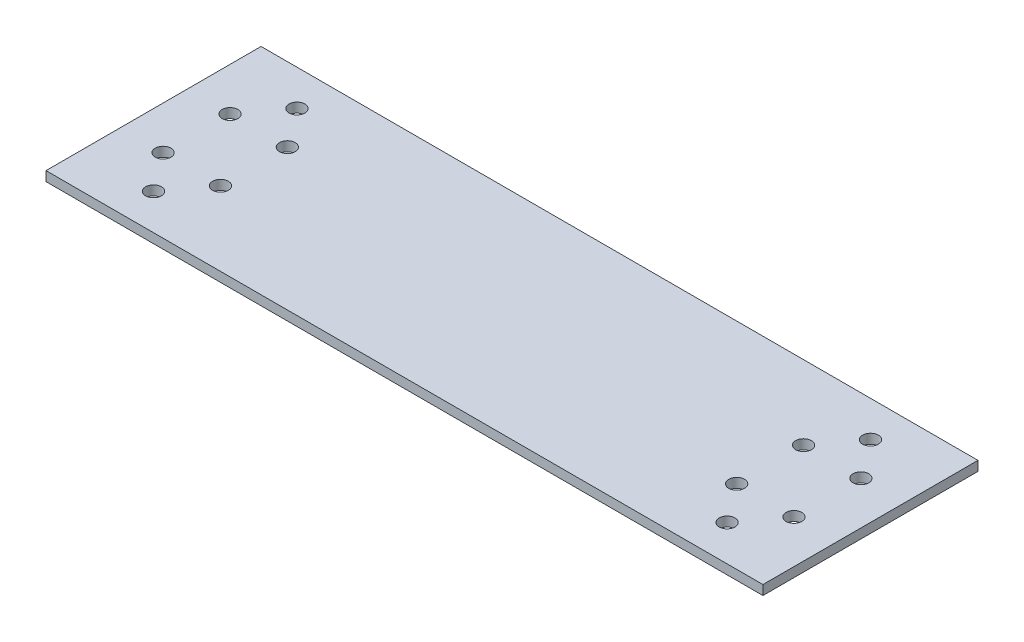
from build123d import *

# Parameters (mm, degrees)
SKETCH_1_W               = 150
SKETCH_1_H               = 45
EXTRUDE_1_DEPTH          = 2
CUT_EXTRUDE_1_REACH      = 80.328
SKETCH_2_R               = 1.65
MIRROR_2_COPY_1_REACH    = 80.328
MIRROR_2_COPY_1_SKETCH_R = 1.65


with BuildPart() as part:
    # 草图1 → 凸台-拉伸1 (new body)
    with BuildSketch(Plane(origin=(0, 0, 0), x_dir=(1, 0, 0), z_dir=(0, 1, 0))):
        Rectangle(SKETCH_1_W, SKETCH_1_H)
    extrude(amount=EXTRUDE_1_DEPTH)

    # 草图2 → 切除-拉伸1 (cut, up to next)
    with BuildSketch(Plane(origin=(0, 2, 0), x_dir=(1, 0, 0), z_dir=(0, 1, 0)), mode=Mode.PRIVATE) as cut_extrude_1_sk1:
        with Locations(Location((-60, 15, 0), (0, 0, 270))):
            Circle(SKETCH_2_R)
    cut_extrude_1_tool1 = extrude(cut_extrude_1_sk1.sketch, amount=-CUT_EXTRUDE_1_REACH, mode=Mode.PRIVATE) & part.part
    # 草图2 → 切除-拉伸1 (cut, up to next)
    with BuildSketch(Plane(origin=(0, 2, 0), x_dir=(1, 0, 0), z_dir=(0, 1, 0)), mode=Mode.PRIVATE) as cut_extrude_1_sk2:
        with Locations(Location((-66, 7, 0), (0, 0, 270))):
            Circle(SKETCH_2_R)
    cut_extrude_1_tool2 = extrude(cut_extrude_1_sk2.sketch, amount=-CUT_EXTRUDE_1_REACH, mode=Mode.PRIVATE) & part.part
    # 草图2 → 切除-拉伸1 (cut, up to next)
    with BuildSketch(Plane(origin=(0, 2, 0), x_dir=(1, 0, 0), z_dir=(0, 1, 0)), mode=Mode.PRIVATE) as cut_extrude_1_sk3:
        with Locations(Location((-54, 7, 0), (0, 0, 270))):
            Circle(SKETCH_2_R)
    cut_extrude_1_tool3 = extrude(cut_extrude_1_sk3.sketch, amount=-CUT_EXTRUDE_1_REACH, mode=Mode.PRIVATE) & part.part
    cut_extrude_1_1 = cut_extrude_1_tool1.solids().sort_by_distance((-60, 2, -15))[0]
    add(cut_extrude_1_1, mode=Mode.SUBTRACT)
    cut_extrude_1_2 = cut_extrude_1_tool2.solids().sort_by_distance((-66, 2, -7))[0]
    add(cut_extrude_1_2, mode=Mode.SUBTRACT)
    cut_extrude_1_3 = cut_extrude_1_tool3.solids().sort_by_distance((-54, 2, -7))[0]
    add(cut_extrude_1_3, mode=Mode.SUBTRACT)
    cut_extrude_1 = cut_extrude_1_1 + cut_extrude_1_2 + cut_extrude_1_3  # 切除-拉伸1 as one shape, for the pattern or mirror that repeats it

    # 镜向1: 切除-拉伸1 across plane
    add(cut_extrude_1.mirror(Plane.XY), mode=Mode.SUBTRACT)

    # 镜向2: 切除-拉伸1 across plane
    add(cut_extrude_1.mirror(Plane(origin=(0, 0, 0), x_dir=(0, 0, 1), z_dir=(1, 0, 0))), mode=Mode.SUBTRACT)

    # 镜向2 copy 1 sketch → 镜向2 copy 1 (cut, up to next)
    with BuildSketch(Plane(origin=(0, 2, 0), x_dir=(-1, 0, 0), z_dir=(0, 1, 0)), mode=Mode.PRIVATE) as mirror_2_copy_1_sk1:
        with Locations(Location((-60, 15, 0), (0, 0, 270))):
            Circle(MIRROR_2_COPY_1_SKETCH_R)
    mirror_2_copy_1_tool1 = extrude(mirror_2_copy_1_sk1.sketch, amount=-MIRROR_2_COPY_1_REACH, mode=Mode.PRIVATE) & part.part
    # 镜向2 copy 1 sketch → 镜向2 copy 1 (cut, up to next)
    with BuildSketch(Plane(origin=(0, 2, 0), x_dir=(-1, 0, 0), z_dir=(0, 1, 0)), mode=Mode.PRIVATE) as mirror_2_copy_1_sk2:
        with Locations(Location((-66, 7, 0), (0, 0, 270))):
            Circle(MIRROR_2_COPY_1_SKETCH_R)
    mirror_2_copy_1_tool2 = extrude(mirror_2_copy_1_sk2.sketch, amount=-MIRROR_2_COPY_1_REACH, mode=Mode.PRIVATE) & part.part
    # 镜向2 copy 1 sketch → 镜向2 copy 1 (cut, up to next)
    with BuildSketch(Plane(origin=(0, 2, 0), x_dir=(-1, 0, 0), z_dir=(0, 1, 0)), mode=Mode.PRIVATE) as mirror_2_copy_1_sk3:
        with Locations(Location((-54, 7, 0), (0, 0, 270))):
            Circle(MIRROR_2_COPY_1_SKETCH_R)
    mirror_2_copy_1_tool3 = extrude(mirror_2_copy_1_sk3.sketch, amount=-MIRROR_2_COPY_1_REACH, mode=Mode.PRIVATE) & part.part
    add(mirror_2_copy_1_tool1.solids().sort_by_distance((60, 2, 15))[0], mode=Mode.SUBTRACT)
    add(mirror_2_copy_1_tool2.solids().sort_by_distance((66, 2, 7))[0], mode=Mode.SUBTRACT)
    add(mirror_2_copy_1_tool3.solids().sort_by_distance((54, 2, 7))[0], mode=Mode.SUBTRACT)


solid = part.part
